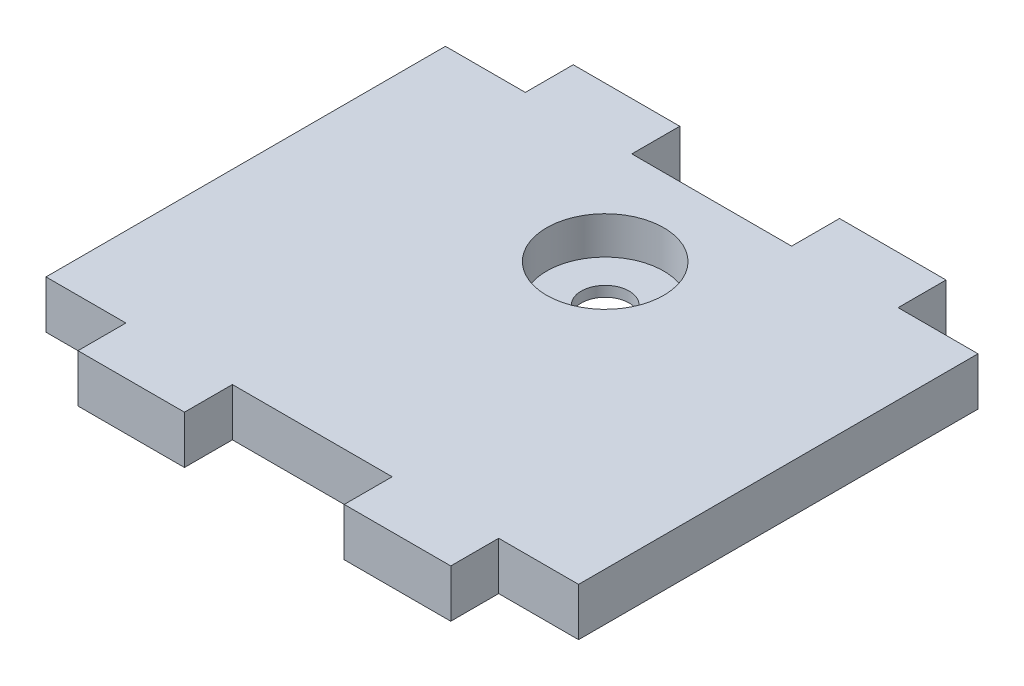
from build123d import *

# Parameters (mm, degrees)
BOSS_EXTRUDE1_DEPTH = 9
SKETCH3_R           = 11
CUT_EXTRUDE1_DEPTH  = 7.05


with BuildPart() as part:
    # Sketch2 → Boss-Extrude1 (new body)
    with BuildSketch(Plane(origin=(0, 0, 0), x_dir=(1, 0, 0), z_dir=(0, 1, 0))):
        Polygon((-35, 37.5), (-50, 37.5), (-50, -37.5), (-35, -37.5), (-35, -46.5), (-15, -46.5), (-15, -37.5), (15, -37.5), (15, -46.5), (35, -46.5), (35, -37.5), (50, -37.5), (50, 37.5), (35, 37.5), (35, 46.5), (15, 46.5), (15, 37.5), (-15, 37.5), (-15, 46.5), (-35, 46.5), align=None)
        with BuildLine():
            ThreePointArc((4.5, 17.5), (0, 13), (-4.5, 17.5))
            ThreePointArc((-4.5, 17.5), (0, 22), (4.5, 17.5))
        make_face(mode=Mode.SUBTRACT)
    extrude(amount=BOSS_EXTRUDE1_DEPTH)

    # Sketch3 → Cut-Extrude1 (cut)
    with BuildSketch(Plane(origin=(0, 9, 0), x_dir=(1, 0, 0), z_dir=(0, 1, 0))):
        with Locations(Location((0, 17.5, 0), (0, 0, 270))):
            Circle(SKETCH3_R)
    extrude(amount=-CUT_EXTRUDE1_DEPTH, mode=Mode.SUBTRACT)


solid = part.part
